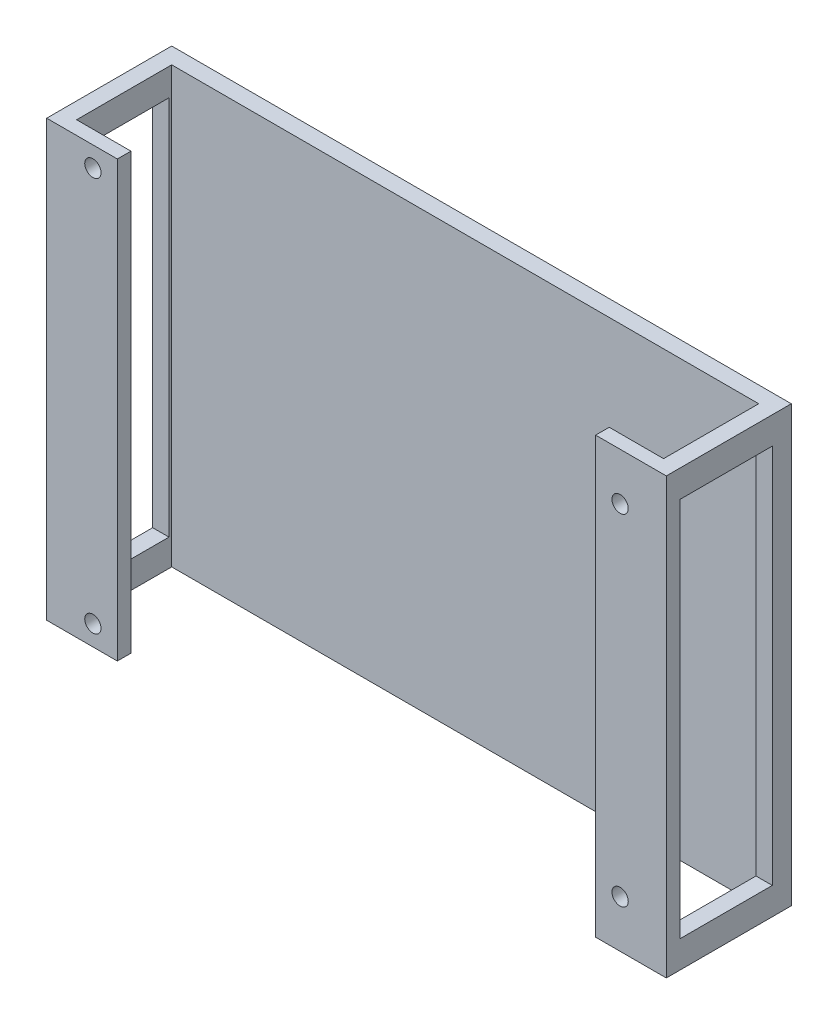
from build123d import *

# Parameters (mm, degrees)
SKETCH10_W              = 114
SKETCH10_H              = 80
BOSS_EXTRUDE6_DEPTH     = 3
SKETCH12_W              = 3
SKETCH12_H              = 80
BOSS_EXTRUDE7_DEPTH     = 20
SKETCH13_W              = 2.5
SKETCH13_H              = 80
BOSS_EXTRUDE8_DEPTH     = 10
SKETCH16_W              = 16
SKETCH16_H              = 70
CUT_EXTRUDE3_DEPTH      = 135.434200024
SKETCH18_R              = 1.5
CUT_EXTRUDE4_DEPTH      = 10
CUT_EXTRUDE5_DEPTH      = 132.899788234
CUT_EXTRUDE5_DEPTH_BACK = 132.899788234
SKETCH19_W              = 1
SKETCH19_H              = 70


with BuildPart() as part:
    # Sketch10 → Boss-Extrude6 (new body)
    with BuildSketch(Plane.XY):
        with Locations((23.926213283, 27.43555543)):
            Rectangle(SKETCH10_W, SKETCH10_H)
    extrude(amount=BOSS_EXTRUDE6_DEPTH)

    # Sketch12 → Boss-Extrude7 (add)
    with BuildSketch(Plane.XY.offset(3)):
        with Locations((-31.573786717, 27.43555543)):
            Rectangle(SKETCH12_W, SKETCH12_H)
    boss_extrude7 = extrude(amount=BOSS_EXTRUDE7_DEPTH)

    # Sketch13 → Boss-Extrude8 (add)
    with BuildSketch(Plane(origin=(-30.073786717, 0, 0), x_dir=(0, 0, -1), z_dir=(1, 0, 0))):
        with Locations((-21.75, 27.43555543)):
            Rectangle(SKETCH13_W, SKETCH13_H)
    boss_extrude8 = extrude(amount=BOSS_EXTRUDE8_DEPTH)

    # Mirror3: Boss-Extrude7, Boss-Extrude8 across plane
    add(boss_extrude7.mirror(Plane.ZY.offset(-23.926213283)))
    add(boss_extrude8.mirror(Plane.ZY.offset(-23.926213283)))

    # Sketch16 → Cut-Extrude3 (cut, through all)
    with BuildSketch(Plane.ZY.offset(33.073786717)):
        with Locations((11.5, 27.43555543)):
            Rectangle(SKETCH16_W, SKETCH16_H)
    extrude(amount=-CUT_EXTRUDE3_DEPTH, mode=Mode.SUBTRACT)

    # Sketch18 → Cut-Extrude4 (cut)
    with BuildSketch(Plane.XY.offset(23)):
        with Locations((-24.573786717, 63.728579771)):
            Circle(SKETCH18_R)
        with Locations((-24.573786717, -8.857468911)):
            Circle(SKETCH18_R)
        with Locations((72.426213283, 58.728579771)):
            Circle(SKETCH18_R)
        with Locations((72.426213283, -3.857468911)):
            Circle(SKETCH18_R)
    extrude(amount=-CUT_EXTRUDE4_DEPTH, mode=Mode.SUBTRACT)

    # Sketch19 → Cut-Extrude5 (cut, two sides: drawn at the far end of the back side and taken through both)
    with BuildSketch(Plane.ZY.offset(-77.926213283).offset(-CUT_EXTRUDE5_DEPTH_BACK)):
        with Locations((20, 27.43555543)):
            Rectangle(SKETCH19_W, SKETCH19_H)
    extrude(amount=CUT_EXTRUDE5_DEPTH + CUT_EXTRUDE5_DEPTH_BACK, mode=Mode.SUBTRACT)


solid = part.part
